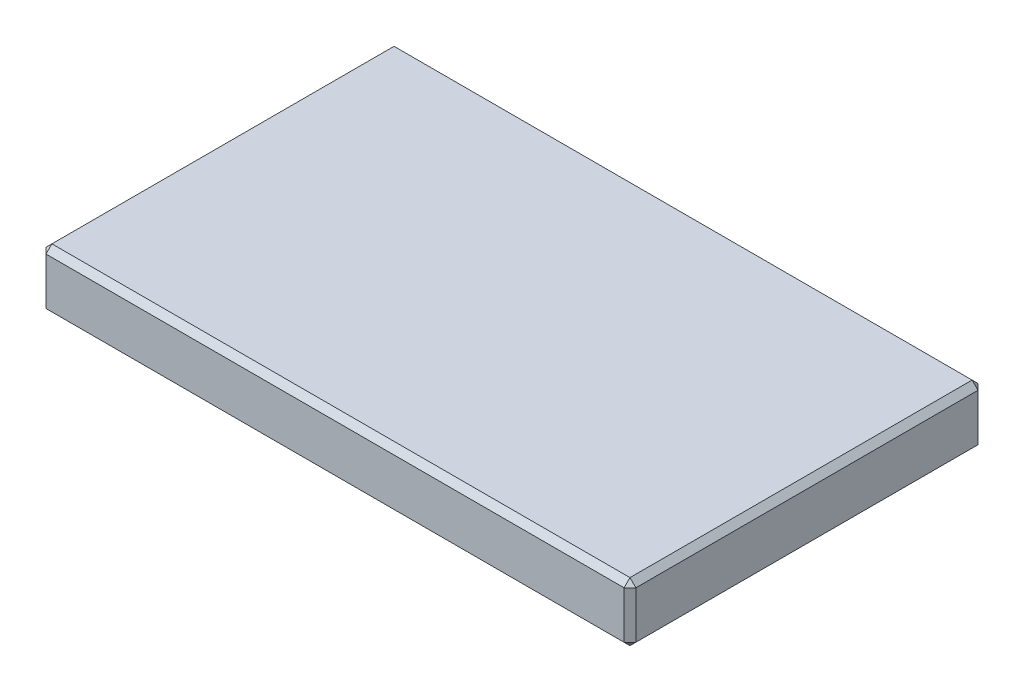
from build123d import *

# Parameters (mm, degrees)
SKETCH1_W           = 500
SKETCH1_H           = 300
BOSS_EXTRUDE1_DEPTH = 50
CHAMFER1_SIZE       = 5


with BuildPart() as part:
    # Sketch1 → Boss-Extrude1 (new body)
    with BuildSketch(Plane(origin=(0, 0, 0), x_dir=(1, 0, 0), z_dir=(0, 1, 0))):
        Rectangle(SKETCH1_W, SKETCH1_H)
    extrude(amount=BOSS_EXTRUDE1_DEPTH)

    # Chamfer1
    chamfer1_edges = [part.edges().sort_by_distance(p)[0] for p in [
        (0, 0, 150),
        (250, 0, 0),
        (0, 0, -150),
        (-250, 0, 0),
        (0, 50, -150),
        (250, 25, -150),
        (250, 50, 0),
        (250, 25, 150),
        (0, 50, 150),
        (-250, 25, -150),
        (-250, 50, 0),
        (-250, 25, 150),
    ]]
    chamfer(chamfer1_edges, length=CHAMFER1_SIZE)


solid = part.part
